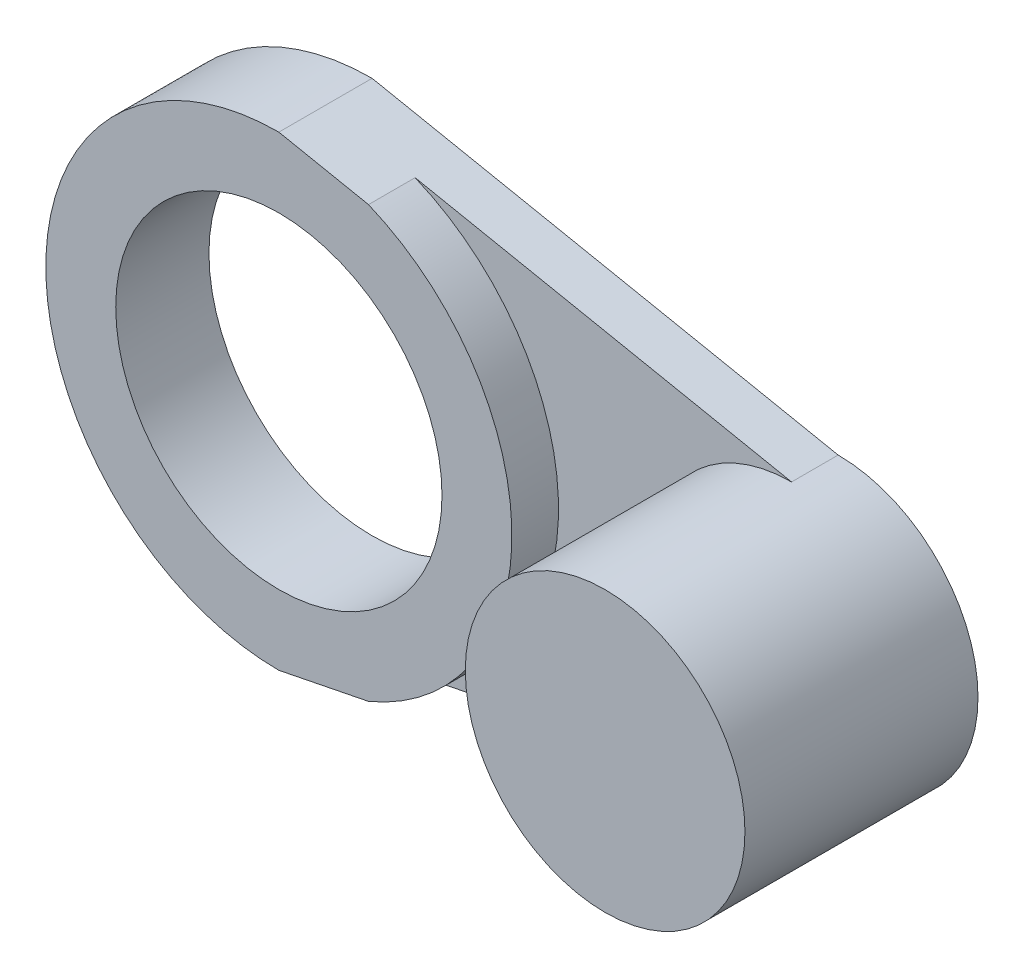
from build123d import *

# Parameters (mm, degrees)
BOSS_EXTRUDE1_DEPTH      = 5
BOSS_EXTRUDE2_DEPTH      = 20
BOSS_EXTRUDE2_DEPTH_BACK = 5
BOSS_EXTRUDE3_DEPTH      = 5
BOSS_EXTRUDE3_DEPTH_BACK = 5
SKETCH1_4_R              = 17.5


with BuildPart() as part:
    # Sketch1 → Boss-Extrude1 (new body)
    with BuildSketch(Plane.XY):
        with BuildLine():
            Line((50, 15), (9.615384615, 23.076923077))
            ThreePointArc((9.615384615, 23.076923077), (20.801257358, 13.867504906), (25, 0))
            ThreePointArc((25, 0), (20.801257358, -13.867504906), (9.615384615, -23.076923077))
            Line((9.615384615, -23.076923077), (50, -15))
            ThreePointArc((50, -15), (35, 0), (50, 15))
        make_face()
    extrude(amount=-BOSS_EXTRUDE1_DEPTH)

    # Sketch1<3> → Boss-Extrude2 (add, two sides: drawn at the far end of the back side and taken through both)
    with BuildSketch(Plane.XY.offset(-BOSS_EXTRUDE2_DEPTH_BACK)):
        with BuildLine():
            ThreePointArc((65, 0), (60.606601718, 10.606601718), (50, 15))
            ThreePointArc((50, 15), (35, 0), (50, -15))
            ThreePointArc((50, -15), (60.606601718, -10.606601718), (65, 0))
        make_face()
    extrude(amount=BOSS_EXTRUDE2_DEPTH + BOSS_EXTRUDE2_DEPTH_BACK)

    # Sketch1<4> → Boss-Extrude3 (add, two sides: drawn at the far end of the back side and taken through both)
    with BuildSketch(Plane.XY.offset(-BOSS_EXTRUDE3_DEPTH_BACK)):
        with BuildLine():
            Line((9.615384615, 23.076923077), (0, 25))
            ThreePointArc((0, 25), (-25, 0), (0, -25))
            Line((0, -25), (9.615384615, -23.076923077))
            ThreePointArc((9.615384615, -23.076923077), (20.801257358, -13.867504906), (25, 0))
            ThreePointArc((25, 0), (20.801257358, 13.867504906), (9.615384615, 23.076923077))
        make_face()
        Circle(SKETCH1_4_R, mode=Mode.SUBTRACT)
    extrude(amount=BOSS_EXTRUDE3_DEPTH + BOSS_EXTRUDE3_DEPTH_BACK)


solid = part.part
